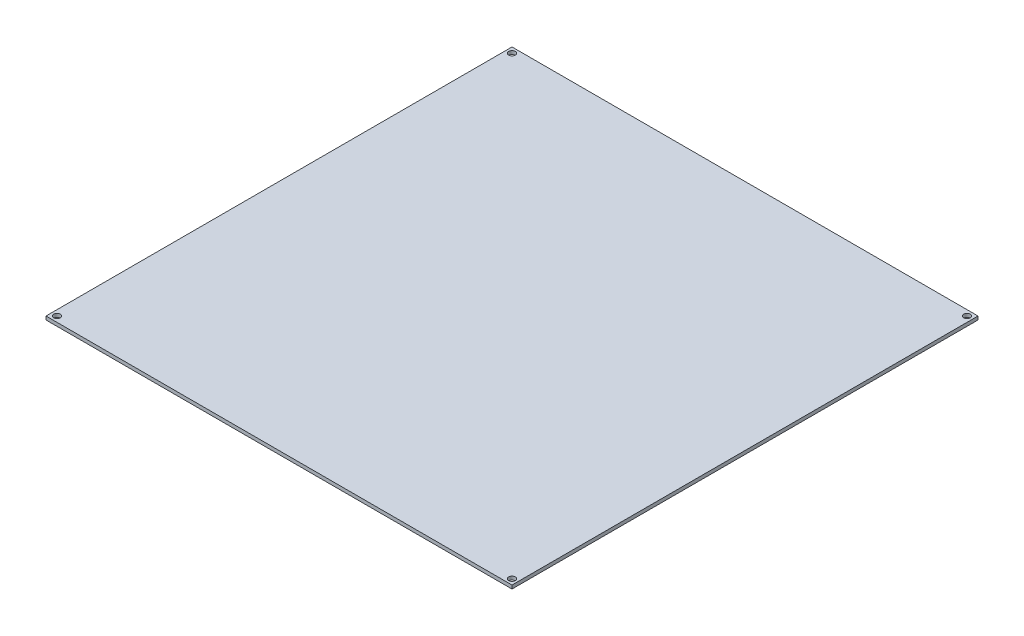
from build123d import *

# Parameters (mm, degrees)
SKETCH1_W           = 214
SKETCH1_H           = 214
SKETCH1_R           = 1.5
BOSS_EXTRUDE1_DEPTH = 0.8


with BuildPart() as part:
    # Sketch1 → Boss-Extrude1 (new, symmetric)
    with BuildSketch(Plane(origin=(0, 0, 0), x_dir=(1, 0, 0), z_dir=(0, 1, 0))):
        Rectangle(SKETCH1_W, SKETCH1_H)
        with Locations(Location((-104.5, 104.5, 0), (0, 0, 270))):
            Circle(SKETCH1_R, mode=Mode.SUBTRACT)
        with Locations(Location((104.5, 104.5, 0), (0, 0, 90))):
            Circle(SKETCH1_R, mode=Mode.SUBTRACT)
        with Locations(Location((-104.5, -104.5, 0), (0, 0, 90))):
            Circle(SKETCH1_R, mode=Mode.SUBTRACT)
        with Locations(Location((104.5, -104.5, 0), (0, 0, 270))):
            Circle(SKETCH1_R, mode=Mode.SUBTRACT)
    extrude(amount=BOSS_EXTRUDE1_DEPTH, both=True)


solid = part.part
